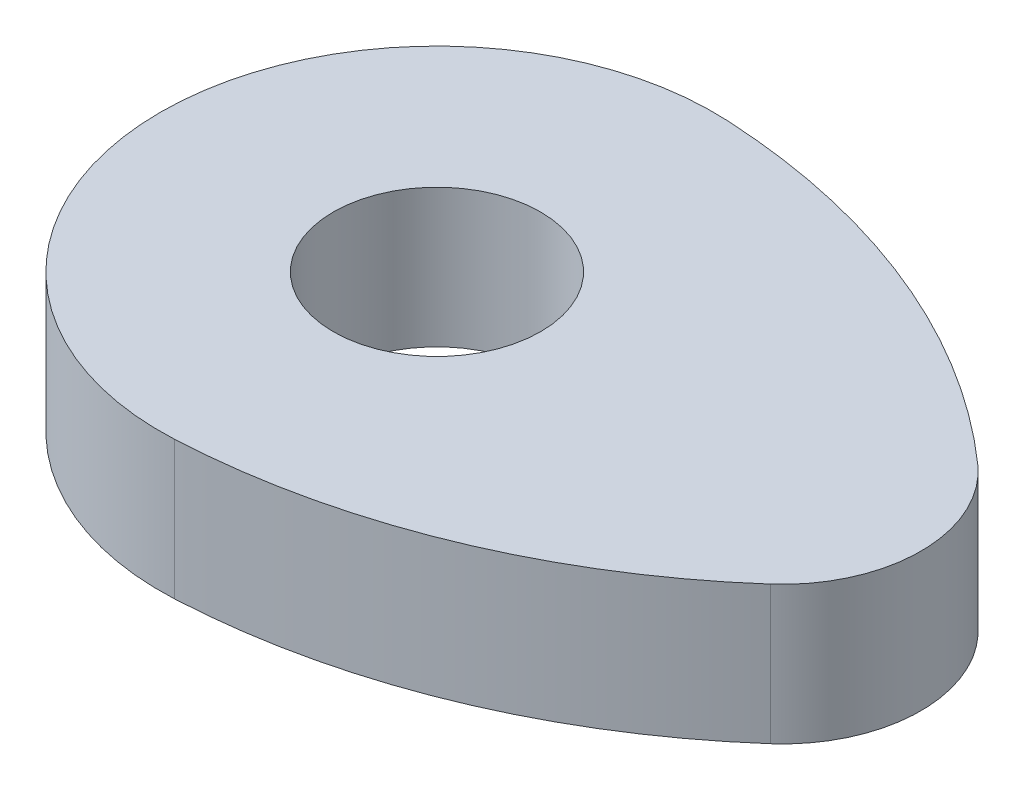
from build123d import *

# Parameters (mm, degrees)
SKETCH1_R           = 7.5
BOSS_EXTRUDE1_DEPTH = 5


with BuildPart() as part:
    # Sketch1 → Boss-Extrude1 (new, symmetric)
    with BuildSketch(Plane(origin=(0, 0, 0), x_dir=(1, 0, 0), z_dir=(0, 1, 0))):
        with BuildLine():
            ThreePointArc((1, 19.974984355), (-20, 0), (1, -19.974984355))
            ThreePointArc((1, -19.974984355), (17.374586088, -16.33817141), (31.625, -7.490619133))
            ThreePointArc((31.625, -7.490619133), (35, 0), (31.625, 7.490619133))
            ThreePointArc((31.625, 7.490619133), (17.374586088, 16.33817141), (1, 19.974984355))
        make_face()
        Circle(SKETCH1_R, mode=Mode.SUBTRACT)
    extrude(amount=BOSS_EXTRUDE1_DEPTH, both=True)


solid = part.part
